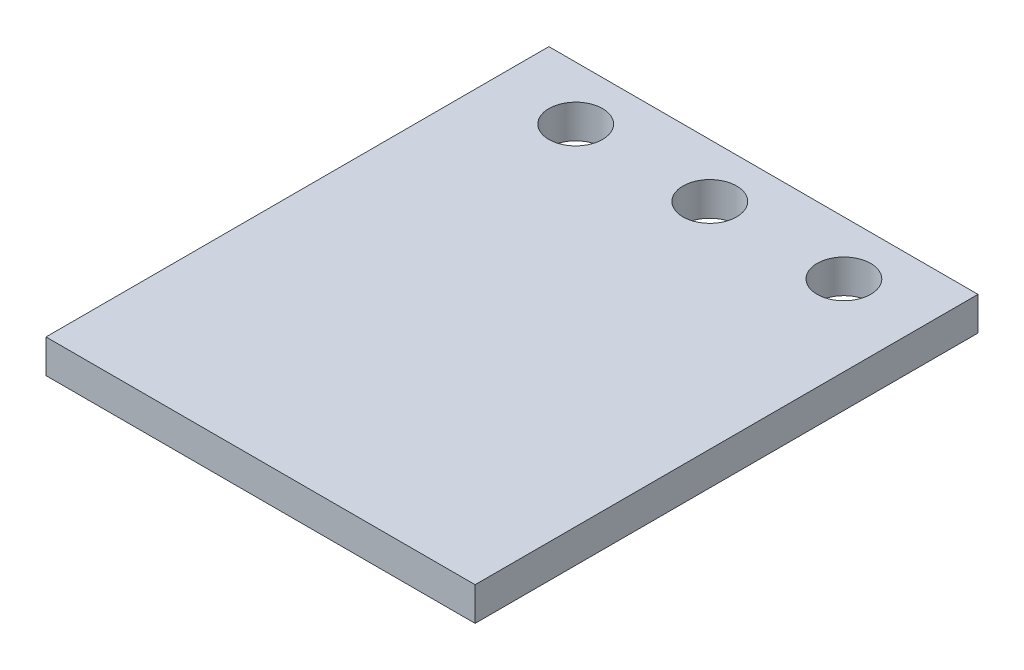
from build123d import *

# Parameters (mm, degrees)
CROQUIS2_W              = 320
CROQUIS2_H              = 25
SALIENTE_EXTRUIR1_DEPTH = 375
CORTAR_EXTRUIR1_REACH   = 399.953
CROQUIS3_R              = 20


with BuildPart() as part:
    # Croquis2 → Saliente-Extruir1 (new body)
    with BuildSketch(Plane(origin=(0, 0, 360), x_dir=(-1, 0, 0), z_dir=(0, 0, -1))):
        with Locations((7.754092983, 190.334413862)):
            Rectangle(CROQUIS2_W, CROQUIS2_H)
    extrude(amount=SALIENTE_EXTRUIR1_DEPTH)

    # Croquis3 → Cortar-Extruir1 (cut, up to next)
    with BuildSketch(Plane(origin=(0, 202.834413862, 0), x_dir=(1, 0, 0), z_dir=(0, 1, 0)), mode=Mode.PRIVATE) as cortar_extruir1_sk1:
        with Locations(Location((-107.754092983, -25, 0), (0, 0, 270))):
            Circle(CROQUIS3_R)
    cortar_extruir1_tool1 = extrude(cortar_extruir1_sk1.sketch, amount=-CORTAR_EXTRUIR1_REACH, mode=Mode.PRIVATE) & part.part
    # Croquis3 → Cortar-Extruir1 (cut, up to next)
    with BuildSketch(Plane(origin=(0, 202.834413862, 0), x_dir=(1, 0, 0), z_dir=(0, 1, 0)), mode=Mode.PRIVATE) as cortar_extruir1_sk2:
        with Locations(Location((-7.754092983, -25, 0), (0, 0, 270))):
            Circle(CROQUIS3_R)
    cortar_extruir1_tool2 = extrude(cortar_extruir1_sk2.sketch, amount=-CORTAR_EXTRUIR1_REACH, mode=Mode.PRIVATE) & part.part
    # Croquis3 → Cortar-Extruir1 (cut, up to next)
    with BuildSketch(Plane(origin=(0, 202.834413862, 0), x_dir=(1, 0, 0), z_dir=(0, 1, 0)), mode=Mode.PRIVATE) as cortar_extruir1_sk3:
        with Locations(Location((92.245907017, -25, 0), (0, 0, 270))):
            Circle(CROQUIS3_R)
    cortar_extruir1_tool3 = extrude(cortar_extruir1_sk3.sketch, amount=-CORTAR_EXTRUIR1_REACH, mode=Mode.PRIVATE) & part.part
    add(cortar_extruir1_tool1.solids().sort_by_distance((-107.754093, 202.834414, 25))[0], mode=Mode.SUBTRACT)
    add(cortar_extruir1_tool2.solids().sort_by_distance((-7.754093, 202.834414, 25))[0], mode=Mode.SUBTRACT)
    add(cortar_extruir1_tool3.solids().sort_by_distance((92.245907, 202.834414, 25))[0], mode=Mode.SUBTRACT)


solid = part.part
